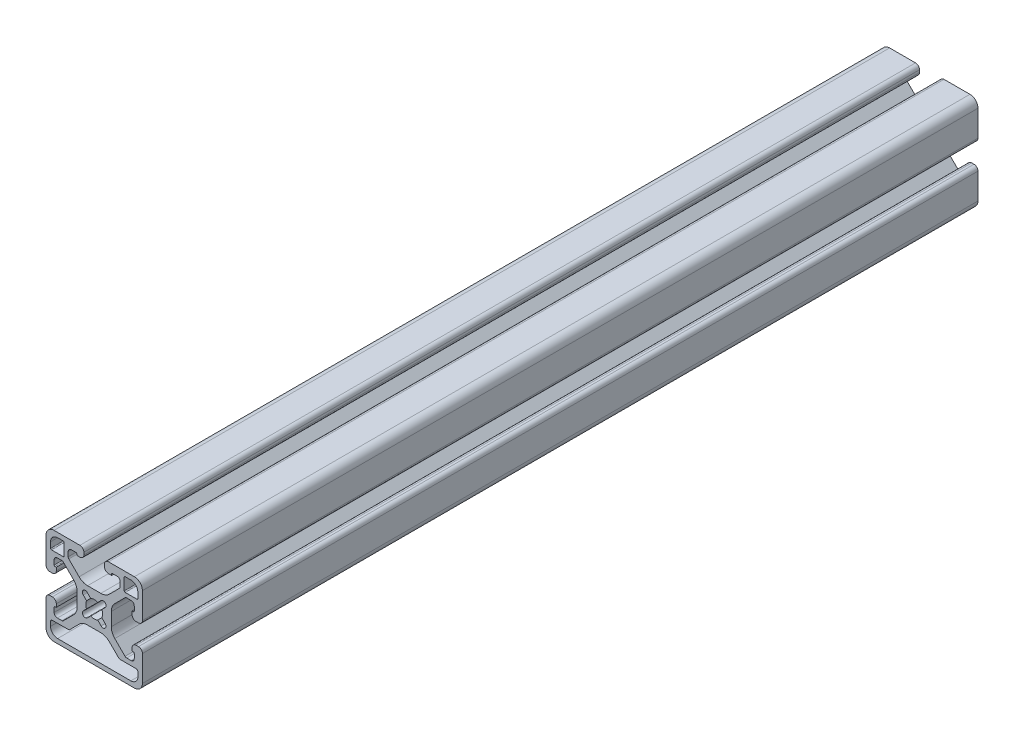
from build123d import *

# Parameters (mm, degrees)
EXTRUDE1_DEPTH     = 165.1
F_7060_LEFT_D      = 6.6548
F_7060_LEFT_DEPTH  = 20.1168
F_7060_LEFT_TIP    = 1.999303624
F_7060_RIGHT_D     = 6.6548
F_7060_RIGHT_DEPTH = 20.1168
F_7060_RIGHT_TIP   = 1.999303624


with BuildPart() as part:
    # Sketch1 → Extrude1 (new, symmetric)
    with BuildSketch(Plane.XY):
        with BuildLine():
            Line((-15.8242, 7.239), (-15.8242, 9.017))
            ThreePointArc((-15.8242, 9.017), (-15.452225612, 9.915025612), (-14.5542, 10.287))
            Line((-14.5542, 10.287), (-12.810497326, 10.287))
            ThreePointArc((-12.810497326, 10.287), (-12.470291755, 10.219328904), (-12.181879398, 10.026617928))
            Line((-12.181879398, 10.026617928), (-8.129198975, 5.973937506))
            ThreePointArc((-8.129198975, 5.973937506), (-7.09957176, 4.432991483), (-6.738014764, 2.615321716))
            Line((-6.738014764, 2.615321716), (-6.738014764, -2.615321716))
            ThreePointArc((-6.738014764, -2.615321716), (-7.09957176, -4.432991483), (-8.129198975, -5.973937506))
            Line((-8.129198975, -5.973937506), (-12.181879398, -10.026617928))
            ThreePointArc((-12.181879398, -10.026617928), (-12.470291755, -10.219328904), (-12.810497326, -10.287))
            Line((-12.810497326, -10.287), (-14.5542, -10.287))
            ThreePointArc((-14.5542, -10.287), (-15.452225612, -9.915025612), (-15.8242, -9.017))
            Line((-15.8242, -9.017), (-15.8242, -7.239))
            ThreePointArc((-15.8242, -7.239), (-15.712607684, -6.969592316), (-15.4432, -6.858))
            Line((-15.4432, -6.858), (-14.986, -6.858))
            Line((-14.986, -6.858), (-14.986, -5.6388))
            ThreePointArc((-14.986, -5.6388), (-15.447248241, -4.525248241), (-16.5608, -4.064))
            Line((-16.5608, -4.064), (-17.4752, -4.064))
            ThreePointArc((-17.4752, -4.064), (-18.588751759, -4.525248241), (-19.05, -5.6388))
            Line((-19.05, -5.6388), (-19.05, -15.875))
            ThreePointArc((-19.05, -15.875), (-18.12006403, -18.12006403), (-15.875, -19.05))
            Line((-15.875, -19.05), (15.875, -19.05))
            ThreePointArc((15.875, -19.05), (18.12006403, -18.12006403), (19.05, -15.875))
            Line((19.05, -15.875), (19.05, -5.6388))
            ThreePointArc((19.05, -5.6388), (18.588751759, -4.525248241), (17.4752, -4.064))
            Line((17.4752, -4.064), (16.5608, -4.064))
            ThreePointArc((16.5608, -4.064), (15.447248241, -4.525248241), (14.986, -5.6388))
            Line((14.986, -5.6388), (14.986, -6.858))
            Line((14.986, -6.858), (15.4432, -6.858))
            ThreePointArc((15.4432, -6.858), (15.712607684, -6.969592316), (15.8242, -7.239))
            Line((15.8242, -7.239), (15.8242, -9.017))
            ThreePointArc((15.8242, -9.017), (15.452225612, -9.915025612), (14.5542, -10.287))
            Line((14.5542, -10.287), (12.810497326, -10.287))
            ThreePointArc((12.810497326, -10.287), (12.470291755, -10.219328904), (12.181879398, -10.026617928))
            Line((12.181879398, -10.026617928), (8.129198975, -5.973937506))
            ThreePointArc((8.129198975, -5.973937506), (7.09957176, -4.432991483), (6.738014764, -2.615321716))
            Line((6.738014764, -2.615321716), (6.738014764, 2.615321716))
            ThreePointArc((6.738014764, 2.615321716), (7.09957176, 4.432991483), (8.129198975, 5.973937506))
            Line((8.129198975, 5.973937506), (12.181879398, 10.026617928))
            ThreePointArc((12.181879398, 10.026617928), (12.470291755, 10.219328904), (12.810497326, 10.287))
            Line((12.810497326, 10.287), (14.5542, 10.287))
            ThreePointArc((14.5542, 10.287), (15.452225612, 9.915025612), (15.8242, 9.017))
            Line((15.8242, 9.017), (15.8242, 7.239))
            ThreePointArc((15.8242, 7.239), (15.712607684, 6.969592316), (15.4432, 6.858))
            Line((15.4432, 6.858), (14.986, 6.858))
            Line((14.986, 6.858), (14.986, 5.6388))
            ThreePointArc((14.986, 5.6388), (15.447248241, 4.525248241), (16.5608, 4.064))
            Line((16.5608, 4.064), (17.4752, 4.064))
            ThreePointArc((17.4752, 4.064), (18.588751759, 4.525248241), (19.05, 5.6388))
            Line((19.05, 5.6388), (19.05, 15.875))
            ThreePointArc((19.05, 15.875), (18.12006403, 18.12006403), (15.875, 19.05))
            Line((15.875, 19.05), (5.6388, 19.05))
            ThreePointArc((5.6388, 19.05), (4.525248241, 18.588751759), (4.064, 17.4752))
            Line((4.064, 17.4752), (4.064, 16.5608))
            ThreePointArc((4.064, 16.5608), (4.525248241, 15.447248241), (5.6388, 14.986))
            Line((5.6388, 14.986), (6.858, 14.986))
            Line((6.858, 14.986), (6.858, 15.4432))
            ThreePointArc((6.858, 15.4432), (6.969592316, 15.712607684), (7.239, 15.8242))
            Line((7.239, 15.8242), (9.017, 15.8242))
            ThreePointArc((9.017, 15.8242), (9.915025612, 15.452225612), (10.287, 14.5542))
            Line((10.287, 14.5542), (10.287, 12.810497326))
            ThreePointArc((10.287, 12.810497326), (10.219328904, 12.470291755), (10.026617928, 12.181879398))
            Line((10.026617928, 12.181879398), (5.973937506, 8.129198975))
            ThreePointArc((5.973937506, 8.129198975), (4.432991483, 7.09957176), (2.615321716, 6.738014764))
            Line((2.615321716, 6.738014764), (-2.615321716, 6.738014764))
            ThreePointArc((-2.615321716, 6.738014764), (-4.432991483, 7.09957176), (-5.973937506, 8.129198975))
            Line((-5.973937506, 8.129198975), (-10.026617928, 12.181879398))
            ThreePointArc((-10.026617928, 12.181879398), (-10.219328904, 12.470291755), (-10.287, 12.810497326))
            Line((-10.287, 12.810497326), (-10.287, 14.5542))
            ThreePointArc((-10.287, 14.5542), (-9.915025612, 15.452225612), (-9.017, 15.8242))
            Line((-9.017, 15.8242), (-7.239, 15.8242))
            ThreePointArc((-7.239, 15.8242), (-6.969592316, 15.712607684), (-6.858, 15.4432))
            Line((-6.858, 15.4432), (-6.858, 14.986))
            Line((-6.858, 14.986), (-5.6388, 14.986))
            ThreePointArc((-5.6388, 14.986), (-4.525248241, 15.447248241), (-4.064, 16.5608))
            Line((-4.064, 16.5608), (-4.064, 17.4752))
            ThreePointArc((-4.064, 17.4752), (-4.525248241, 18.588751759), (-5.6388, 19.05))
            Line((-5.6388, 19.05), (-15.875, 19.05))
            ThreePointArc((-15.875, 19.05), (-18.12006403, 18.12006403), (-19.05, 15.875))
            Line((-19.05, 15.875), (-19.05, 5.6388))
            ThreePointArc((-19.05, 5.6388), (-18.588751759, 4.525248241), (-17.4752, 4.064))
            Line((-17.4752, 4.064), (-16.5608, 4.064))
            ThreePointArc((-16.5608, 4.064), (-15.447248241, 4.525248241), (-14.986, 5.6388))
            Line((-14.986, 5.6388), (-14.986, 6.858))
            Line((-14.986, 6.858), (-15.4432, 6.858))
            ThreePointArc((-15.4432, 6.858), (-15.712607684, 6.969592316), (-15.8242, 7.239))
        make_face()
        with BuildLine():
            Line((-2.615321716, -6.738014764), (2.615321716, -6.738014764))
            ThreePointArc((2.615321716, -6.738014764), (4.432991483, -7.09957176), (5.973937506, -8.129198975))
            Line((5.973937506, -8.129198975), (9.686553898, -11.841815367))
            ThreePointArc((9.686553898, -11.841815367), (9.93376449, -12.006996204), (10.225369265, -12.065))
            Line((10.225369265, -12.065), (16.51, -12.065))
            ThreePointArc((16.51, -12.065), (17.048815367, -12.288184633), (17.272, -12.827))
            Line((17.272, -12.827), (17.272, -14.478))
            ThreePointArc((17.272, -14.478), (16.453656347, -16.453656347), (14.478, -17.272))
            Line((14.478, -17.272), (-14.478, -17.272))
            ThreePointArc((-14.478, -17.272), (-16.453656347, -16.453656347), (-17.272, -14.478))
            Line((-17.272, -14.478), (-17.272, -12.827))
            ThreePointArc((-17.272, -12.827), (-17.048815367, -12.288184633), (-16.51, -12.065))
            Line((-16.51, -12.065), (-10.225369265, -12.065))
            ThreePointArc((-10.225369265, -12.065), (-9.93376449, -12.006996204), (-9.686553898, -11.841815367))
            Line((-9.686553898, -11.841815367), (-5.973937506, -8.129198975))
            ThreePointArc((-5.973937506, -8.129198975), (-4.432991483, -7.09957176), (-2.615321716, -6.738014764))
        make_face(mode=Mode.SUBTRACT)
        with BuildLine():
            Line((16.8656, 11.8618), (12.2428, 11.8618))
            ThreePointArc((12.2428, 11.8618), (11.973392316, 11.973392316), (11.8618, 12.2428))
            Line((11.8618, 12.2428), (11.8618, 16.8656))
            ThreePointArc((11.8618, 16.8656), (11.973392316, 17.135007684), (12.2428, 17.2466))
            Line((12.2428, 17.2466), (14.4526, 17.2466))
            ThreePointArc((14.4526, 17.2466), (16.428256347, 16.428256347), (17.2466, 14.4526))
            Line((17.2466, 14.4526), (17.2466, 12.2428))
            ThreePointArc((17.2466, 12.2428), (17.135007684, 11.973392316), (16.8656, 11.8618))
        make_face(mode=Mode.SUBTRACT)
        with BuildLine():
            Line((-11.8618, 16.8656), (-11.8618, 12.2428))
            ThreePointArc((-11.8618, 12.2428), (-11.973392316, 11.973392316), (-12.2428, 11.8618))
            Line((-12.2428, 11.8618), (-16.8656, 11.8618))
            ThreePointArc((-16.8656, 11.8618), (-17.135007684, 11.973392316), (-17.2466, 12.2428))
            Line((-17.2466, 12.2428), (-17.2466, 14.4526))
            ThreePointArc((-17.2466, 14.4526), (-16.428256347, 16.428256347), (-14.4526, 17.2466))
            Line((-14.4526, 17.2466), (-12.2428, 17.2466))
            ThreePointArc((-12.2428, 17.2466), (-11.973392316, 17.135007684), (-11.8618, 16.8656))
        make_face(mode=Mode.SUBTRACT)
        with BuildLine():
            Line((1.401430967, 3.017877069), (2.722376949, 4.338823051))
            ThreePointArc((2.722376949, 4.338823051), (4.338823051, 4.338823051), (4.338823051, 2.722376949))
            Line((4.338823051, 2.722376949), (3.017877069, 1.401430967))
            ThreePointArc((3.017877069, 1.401430967), (3.3274, 0), (3.017877069, -1.401430967))
            Line((3.017877069, -1.401430967), (4.338823051, -2.722376949))
            ThreePointArc((4.338823051, -2.722376949), (4.338823051, -4.338823051), (2.722376949, -4.338823051))
            Line((2.722376949, -4.338823051), (1.401430967, -3.017877069))
            ThreePointArc((1.401430967, -3.017877069), (0, -3.3274), (-1.401430967, -3.017877069))
            Line((-1.401430967, -3.017877069), (-2.722376949, -4.338823051))
            ThreePointArc((-2.722376949, -4.338823051), (-4.338823051, -4.338823051), (-4.338823051, -2.722376949))
            Line((-4.338823051, -2.722376949), (-3.017877069, -1.401430967))
            ThreePointArc((-3.017877069, -1.401430967), (-3.3274, 0), (-3.017877069, 1.401430967))
            Line((-3.017877069, 1.401430967), (-4.338823051, 2.722376949))
            ThreePointArc((-4.338823051, 2.722376949), (-4.338823051, 4.338823051), (-2.722376949, 4.338823051))
            Line((-2.722376949, 4.338823051), (-1.401430967, 3.017877069))
            ThreePointArc((-1.401430967, 3.017877069), (0, 3.3274), (1.401430967, 3.017877069))
        make_face(mode=Mode.SUBTRACT)
    extrude(amount=EXTRUDE1_DEPTH, both=True)

    # 7060-LEFT
    with Locations(Plane.XY.offset(165.1)):
        with Locations((0, 0)):
            Hole(F_7060_LEFT_D / 2, depth=F_7060_LEFT_DEPTH)
            with Locations((0, 0, -(F_7060_LEFT_DEPTH + F_7060_LEFT_TIP / 2))):  # 118° drill point
                Cone(0, F_7060_LEFT_D / 2, F_7060_LEFT_TIP, mode=Mode.SUBTRACT)

    # 7060-RIGHT
    with Locations(Plane(origin=(0, 0, -165.1), x_dir=(-1, 0, 0), z_dir=(0, 0, -1))):
        with Locations((0, 0)):
            Hole(F_7060_RIGHT_D / 2, depth=F_7060_RIGHT_DEPTH)
            with Locations((0, 0, -(F_7060_RIGHT_DEPTH + F_7060_RIGHT_TIP / 2))):  # 118° drill point
                Cone(0, F_7060_RIGHT_D / 2, F_7060_RIGHT_TIP, mode=Mode.SUBTRACT)


solid = part.part
